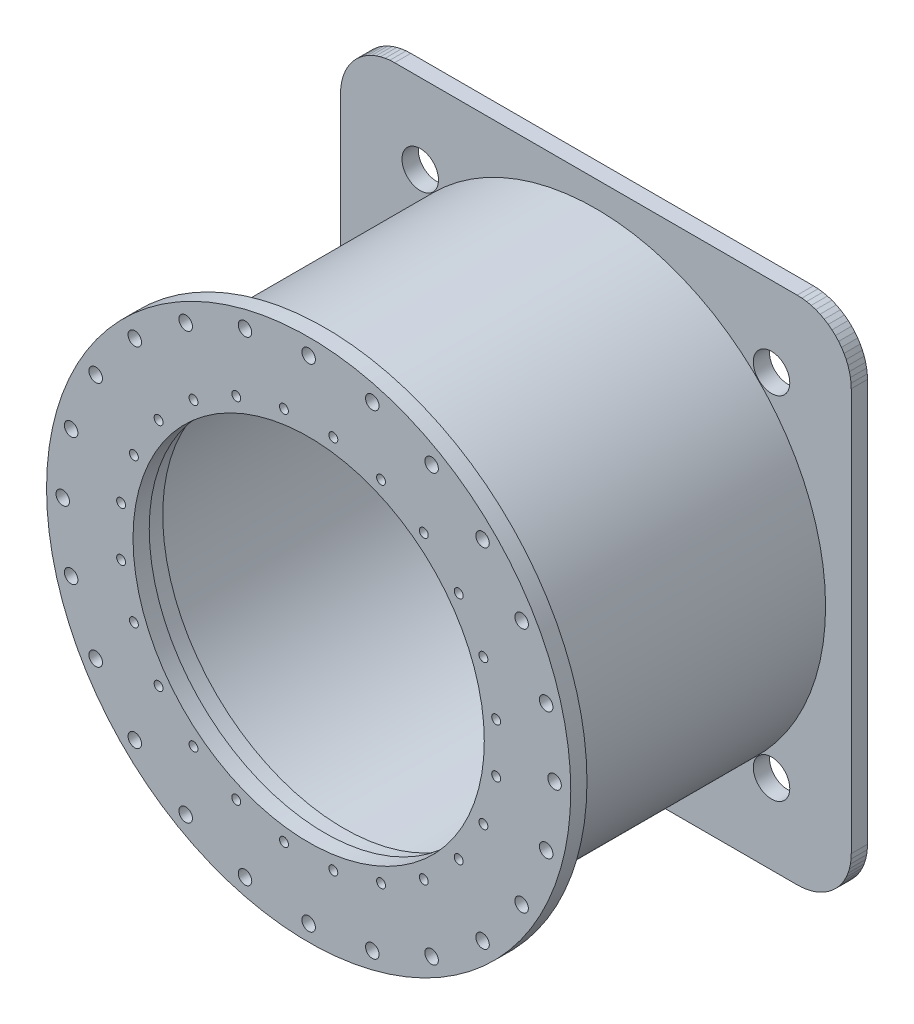
from build123d import *

# Parameters (mm, degrees)
F_01_SQUARE_FLANGE_DEPTH = 6
SKETCH_2_R               = 85
F_02_TUBE_D170_DEPTH     = 100.3
SKETCH_3_R               = 97
F_03_FLANGE_D194_DEPTH   = 6
SKETCH_4_R               = 79
F_04_BORE_D158_DEPTH     = 10
SKETCH_5_R               = 75
F_05_BORE_D150_DEPTH     = 89.3
SKETCH_6_R               = 67
F_06_BORE_D134_DEPTH     = 7
SKETCH_7_R               = 65
F_07_BORE_D130_DEPTH     = 6
SKETCH_8_R               = 2.5
F_08_HOLES_24_D5_DEPTH   = 6
SKETCH_9_R               = 6.75
F_09_HOLES_4_D13_5_DEPTH = 6
SKETCH_10_R              = 1.65
F_10_HOLES_24_M4_DEPTH   = 6


with BuildPart() as part:
    # 草图1 → 01_SQUARE_FLANGE (new body)
    with BuildSketch(Plane.XY):
        Polygon((94.5, 74.5), (94.423893962, 76.243114855), (94.19615506, 77.972963553), (93.818516526, 79.676380902), (93.293852416, 81.340402867), (92.626155741, 82.952365235), (91.820508076, 84.5), (90.883040886, 85.971528727), (89.820888862, 87.355752194), (88.642135624, 88.642135624), (87.355752194, 89.820888862), (85.971528727, 90.883040886), (84.5, 91.820508076), (82.952365235, 92.626155741), (81.340402867, 93.293852416), (79.676380902, 93.818516526), (77.972963553, 94.19615506), (76.243114855, 94.423893962), (74.5, 94.5), (-74.5, 94.5), (-76.243114855, 94.423893962), (-77.972963553, 94.19615506), (-79.676380902, 93.818516526), (-81.340402867, 93.293852416), (-82.952365235, 92.626155741), (-84.5, 91.820508076), (-85.971528727, 90.883040886), (-87.355752194, 89.820888862), (-88.642135624, 88.642135624), (-89.820888862, 87.355752194), (-90.883040886, 85.971528727), (-91.820508076, 84.5), (-92.626155741, 82.952365235), (-93.293852416, 81.340402867), (-93.818516526, 79.676380902), (-94.19615506, 77.972963553), (-94.423893962, 76.243114855), (-94.5, 74.5), (-94.5, -74.5), (-94.423893962, -76.243114855), (-94.19615506, -77.972963553), (-93.818516526, -79.676380902), (-93.293852416, -81.340402867), (-92.626155741, -82.952365235), (-91.820508076, -84.5), (-90.883040886, -85.971528727), (-89.820888862, -87.355752194), (-88.642135624, -88.642135624), (-87.355752194, -89.820888862), (-85.971528727, -90.883040886), (-84.5, -91.820508076), (-82.952365235, -92.626155741), (-81.340402867, -93.293852416), (-79.676380902, -93.818516526), (-77.972963553, -94.19615506), (-76.243114855, -94.423893962), (-74.5, -94.5), (74.5, -94.5), (76.243114855, -94.423893962), (77.972963553, -94.19615506), (79.676380902, -93.818516526), (81.340402867, -93.293852416), (82.952365235, -92.626155741), (84.5, -91.820508076), (85.971528727, -90.883040886), (87.355752194, -89.820888862), (88.642135624, -88.642135624), (89.820888862, -87.355752194), (90.883040886, -85.971528727), (91.820508076, -84.5), (92.626155741, -82.952365235), (93.293852416, -81.340402867), (93.818516526, -79.676380902), (94.19615506, -77.972963553), (94.423893962, -76.243114855), (94.5, -74.5), align=None)
    extrude(amount=F_01_SQUARE_FLANGE_DEPTH)

    # 草图2 → 02_TUBE_D170 (add)
    with BuildSketch(Plane.XY.offset(6)):
        Circle(SKETCH_2_R)
    extrude(amount=F_02_TUBE_D170_DEPTH)

    # 草图3 → 03_FLANGE_D194 (add)
    with BuildSketch(Plane.XY.offset(106.3)):
        Circle(SKETCH_3_R)
    extrude(amount=F_03_FLANGE_D194_DEPTH)

    # 草图4 → 04_BORE_D158 (cut)
    with BuildSketch(Plane.XY):
        Circle(SKETCH_4_R)
    extrude(amount=F_04_BORE_D158_DEPTH, mode=Mode.SUBTRACT)

    # 草图5 → 05_BORE_D150 (cut)
    with BuildSketch(Plane.XY.offset(10)):
        with Locations(Location((0, 0, 0), (0, 0, 180))):
            Circle(SKETCH_5_R)
    extrude(amount=F_05_BORE_D150_DEPTH, mode=Mode.SUBTRACT)

    # 草图6 → 06_BORE_D134 (cut)
    with BuildSketch(Plane.XY.offset(99.3)):
        Circle(SKETCH_6_R)
    extrude(amount=F_06_BORE_D134_DEPTH, mode=Mode.SUBTRACT)

    # 草图7 → 07_BORE_D130 (cut)
    with BuildSketch(Plane.XY.offset(106.3)):
        Circle(SKETCH_7_R)
    extrude(amount=F_07_BORE_D130_DEPTH, mode=Mode.SUBTRACT)

    # 草图8 → 08_HOLES_24_D5 (cut)
    with BuildSketch(Plane.XY.offset(106.3)):
        with Locations((91, 0)):
            Circle(SKETCH_8_R)
        with Locations((87.899250192, 23.552533104)):
            Circle(SKETCH_8_R)
        with Locations((78.808311744, 45.5)):
            Circle(SKETCH_8_R)
        with Locations((64.346717088, 64.346717088)):
            Circle(SKETCH_8_R)
        with Locations((45.5, 78.808311744)):
            Circle(SKETCH_8_R)
        with Locations((23.552533104, 87.899250192)):
            Circle(SKETCH_8_R)
        with Locations((0, 91)):
            Circle(SKETCH_8_R)
        with Locations((-23.552533104, 87.899250192)):
            Circle(SKETCH_8_R)
        with Locations((-45.5, 78.808311744)):
            Circle(SKETCH_8_R)
        with Locations((-64.346717088, 64.346717088)):
            Circle(SKETCH_8_R)
        with Locations((-78.808311744, 45.5)):
            Circle(SKETCH_8_R)
        with Locations((-87.899250192, 23.552533104)):
            Circle(SKETCH_8_R)
        with Locations((-91, 0)):
            Circle(SKETCH_8_R)
        with Locations((-87.899250192, -23.552533104)):
            Circle(SKETCH_8_R)
        with Locations((-78.808311744, -45.5)):
            Circle(SKETCH_8_R)
        with Locations((-64.346717088, -64.346717088)):
            Circle(SKETCH_8_R)
        with Locations((-45.5, -78.808311744)):
            Circle(SKETCH_8_R)
        with Locations((-23.552533104, -87.899250192)):
            Circle(SKETCH_8_R)
        with Locations((0, -91)):
            Circle(SKETCH_8_R)
        with Locations((23.552533104, -87.899250192)):
            Circle(SKETCH_8_R)
        with Locations((45.5, -78.808311744)):
            Circle(SKETCH_8_R)
        with Locations((64.346717088, -64.346717088)):
            Circle(SKETCH_8_R)
        with Locations((78.808311744, -45.5)):
            Circle(SKETCH_8_R)
        with Locations((87.899250192, -23.552533104)):
            Circle(SKETCH_8_R)
    extrude(amount=F_08_HOLES_24_D5_DEPTH, mode=Mode.SUBTRACT)

    # 草图9 → 09_HOLES_4_D13.5 (cut)
    with BuildSketch(Plane.XY):
        with Locations((-65, -65)):
            Circle(SKETCH_9_R)
        with Locations((-65, 65)):
            Circle(SKETCH_9_R)
        with Locations((65, -65)):
            Circle(SKETCH_9_R)
        with Locations((65, 65)):
            Circle(SKETCH_9_R)
    extrude(amount=F_09_HOLES_4_D13_5_DEPTH, mode=Mode.SUBTRACT)

    # 草图10 → 10_HOLES_24_M4 (cut)
    with BuildSketch(Plane.XY.offset(106.3)):
        with Locations((69.401140296, 9.136833455)):
            Circle(SKETCH_10_R)
        with Locations((64.671567276, 26.787840266)):
            Circle(SKETCH_10_R)
        with Locations((55.53473382, 42.613300031)):
            Circle(SKETCH_10_R)
        with Locations((42.613300031, 55.53473382)):
            Circle(SKETCH_10_R)
        with Locations((26.787840266, 64.671567276)):
            Circle(SKETCH_10_R)
        with Locations((9.136833455, 69.401140296)):
            Circle(SKETCH_10_R)
        with Locations((-9.136833455, 69.401140296)):
            Circle(SKETCH_10_R)
        with Locations((-26.787840266, 64.671567276)):
            Circle(SKETCH_10_R)
        with Locations((-42.613300031, 55.53473382)):
            Circle(SKETCH_10_R)
        with Locations((-55.53473382, 42.613300031)):
            Circle(SKETCH_10_R)
        with Locations((-64.671567276, 26.787840266)):
            Circle(SKETCH_10_R)
        with Locations((-69.401140296, 9.136833455)):
            Circle(SKETCH_10_R)
        with Locations((-69.401140296, -9.136833455)):
            Circle(SKETCH_10_R)
        with Locations((-64.671567276, -26.787840266)):
            Circle(SKETCH_10_R)
        with Locations((-55.53473382, -42.613300031)):
            Circle(SKETCH_10_R)
        with Locations((-42.613300031, -55.53473382)):
            Circle(SKETCH_10_R)
        with Locations((-26.787840266, -64.671567276)):
            Circle(SKETCH_10_R)
        with Locations((-9.136833455, -69.401140296)):
            Circle(SKETCH_10_R)
        with Locations((9.136833455, -69.401140296)):
            Circle(SKETCH_10_R)
        with Locations((26.787840266, -64.671567276)):
            Circle(SKETCH_10_R)
        with Locations((42.613300031, -55.53473382)):
            Circle(SKETCH_10_R)
        with Locations((55.53473382, -42.613300031)):
            Circle(SKETCH_10_R)
        with Locations((64.671567276, -26.787840266)):
            Circle(SKETCH_10_R)
        with Locations((69.401140296, -9.136833455)):
            Circle(SKETCH_10_R)
    extrude(amount=F_10_HOLES_24_M4_DEPTH, mode=Mode.SUBTRACT)


solid = part.part
